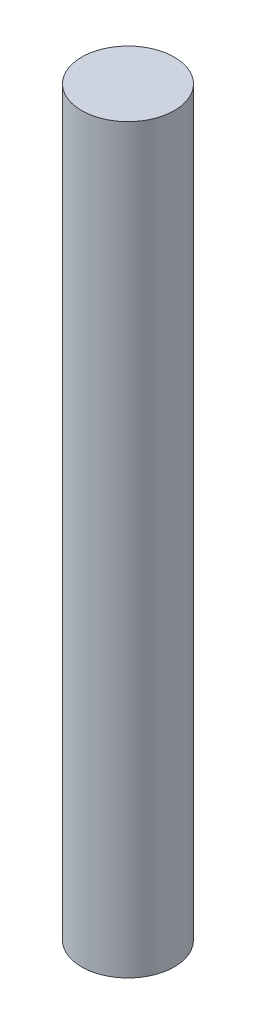
from build123d import *

# Parameters (mm, degrees)
SKETCH1_R           = 3.175
BOSS_EXTRUDE1_DEPTH = 50.8


with BuildPart() as part:
    # Sketch1 → Boss-Extrude1 (new body)
    with BuildSketch(Plane(origin=(0, 0, 0), x_dir=(1, 0, 0), z_dir=(0, 1, 0))):
        with Locations(Location((0, 0, 0), (0, 0, 270))):
            Circle(SKETCH1_R)
    extrude(amount=BOSS_EXTRUDE1_DEPTH)


solid = part.part
